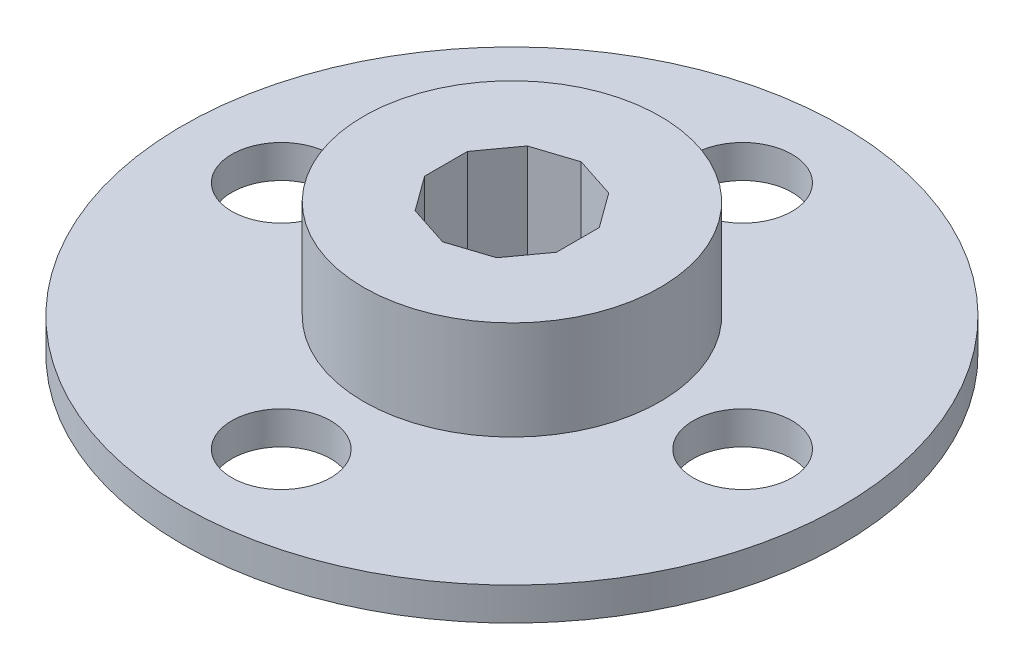
from build123d import *

# Parameters (mm, degrees)
SKETCH1_R           = 10
SKETCH1_R_2         = 1.5
SKETCH1_R_3         = 4.5
BOSS_EXTRUDE1_DEPTH = 1
SKETCH2_R           = 4.5
BOSS_EXTRUDE2_DEPTH = 3


with BuildPart() as part:
    # Sketch1 → Boss-Extrude1 (new body)
    with BuildSketch(Plane(origin=(0, 0, 0), x_dir=(1, 0, 0), z_dir=(0, 1, 0))):
        with Locations(Location((0, 0, 0), (0, 0, 270))):
            Circle(SKETCH1_R)
        with Locations(Location((0, 7, 0), (0, 0, 270))):
            Circle(SKETCH1_R_2, mode=Mode.SUBTRACT)
        with Locations(Location((7, 0, 0), (0, 0, 270))):
            Circle(SKETCH1_R_2, mode=Mode.SUBTRACT)
        with Locations(Location((0, -7, 0), (0, 0, 270))):
            Circle(SKETCH1_R_2, mode=Mode.SUBTRACT)
        with Locations(Location((-7, 0, 0), (0, 0, 270))):
            Circle(SKETCH1_R_2, mode=Mode.SUBTRACT)
        with Locations(Location((0, 0, 0), (0, 0, 270))):
            Circle(SKETCH1_R_3, mode=Mode.SUBTRACT)
    extrude(amount=BOSS_EXTRUDE1_DEPTH)


with BuildPart() as body_2:
    # Sketch2 → Boss-Extrude2 (new body)
    with BuildSketch(Plane(origin=(0, 1, 0), x_dir=(1, 0, 0), z_dir=(0, 1, 0))):
        with Locations(Location((0, 0, 0), (0, 0, 270))):
            Circle(SKETCH2_R)
        Polygon((2, 0.649839392), (1.236067977, 1.701301617), (0, 2.102924448), (-1.236067977, 1.701301617), (-2, 0.649839392), (-2, -0.649839392), (-1.236067977, -1.701301617), (0, -2.102924448), (1.236067977, -1.701301617), (2, -0.649839392), align=None, mode=Mode.SUBTRACT)
    extrude(amount=BOSS_EXTRUDE2_DEPTH)


solid = Compound([part.part, body_2.part])
